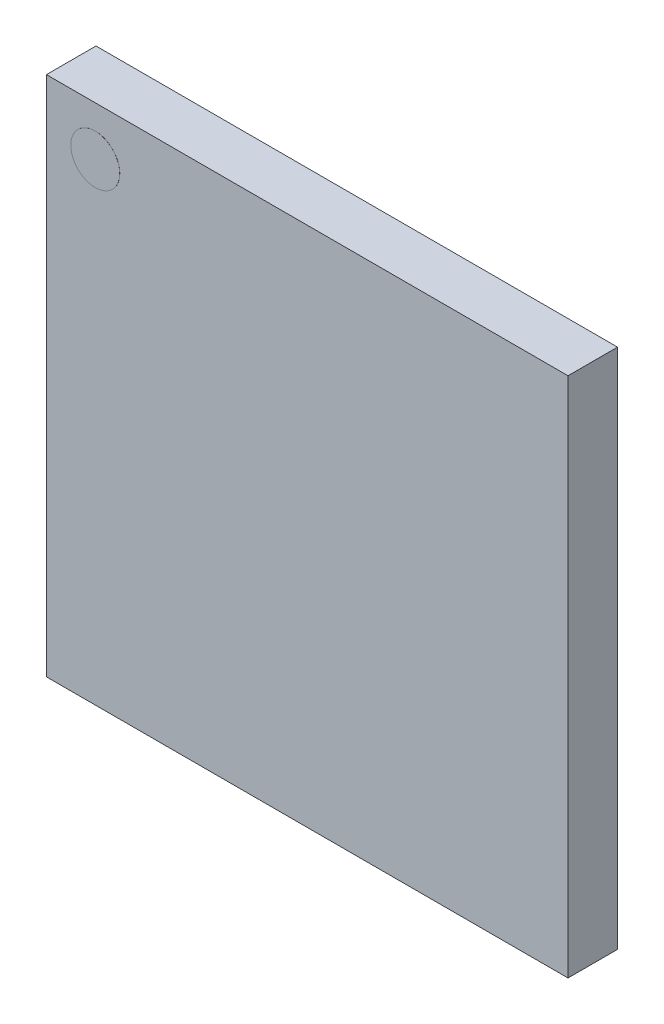
from build123d import *

# Parameters (mm, degrees)
BODY_START            = 0.15
ESQUISSE1_W           = 8
ESQUISSE1_H           = 8
BODY_DEPTH            = 0.76
BALL_ARRAY_COUNT      = 10
BALL_ARRAY_PITCH      = 0.8
BALL_ARRAY_COUNT_DIR2 = 10
BALL_ARRAY_PITCH_DIR2 = 0.8
ESQUISSE3_R           = 0.375
A1_MARK_DEPTH         = 0.001


with BuildPart() as part:
    # Esquisse1 → body (new body)
    with BuildSketch(Plane.XY.offset(BODY_START)):
        Rectangle(ESQUISSE1_W, ESQUISSE1_H)
    extrude(amount=BODY_DEPTH)

    # Esquisse2 → ball A1 (revolve)
    with BuildSketch(Plane(origin=(0, 3.6, 0), x_dir=(1, 0, 0), z_dir=(0, 1, 0))):
        with BuildLine():
            Line((-3.6, 0), (-3.6, -0.275))
            ThreePointArc((-3.6, -0.275), (-3.43416876, -0.186803399), (-3.414595038, 0))
            Line((-3.414595038, 0), (-3.6, 0))
        make_face()
    ball_a1 = revolve(axis=Axis((-3.6, 3.6, 0), (0, 0, 1)))

    # ball array: ball A1 10 × 10
    with Locations(*[(i * BALL_ARRAY_PITCH, -j * BALL_ARRAY_PITCH_DIR2, 0) for i in range(BALL_ARRAY_COUNT) for j in range(BALL_ARRAY_COUNT_DIR2) if (i, j) != (0, 0)]):
        add(ball_a1)

    # Esquisse3 → A1 mark (add)
    with BuildSketch(Plane.XY.offset(0.91)):
        with Locations((-3.25, 3.25)):
            Circle(ESQUISSE3_R)
    extrude(amount=A1_MARK_DEPTH)


solid = part.part
